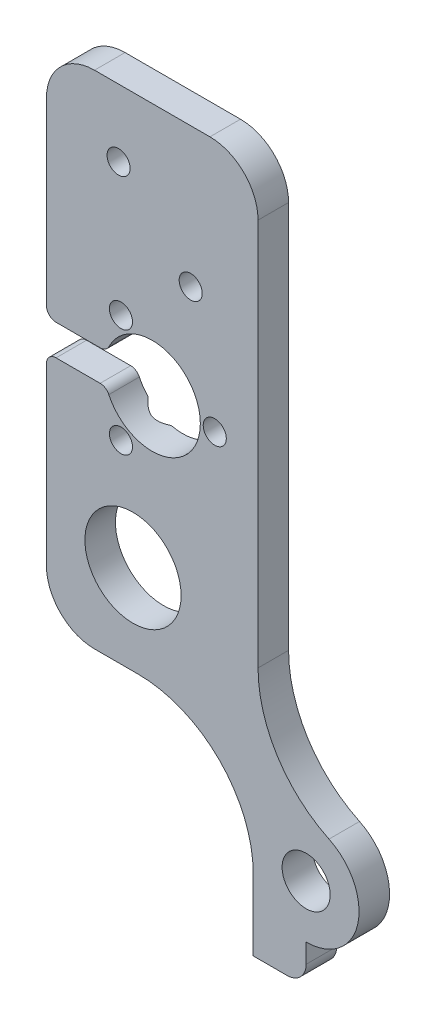
from build123d import *

# Parameters (mm, degrees)
SKETCH1_R                                       = 2.5
SKETCH1_R_2                                     = 5
SKETCH1_R_3                                     = 1
BOSS_EXTRUDE1_DEPTH                             = 3.175
CSK_FOR_M2_FLAT_HEAD_MACHINE_SCREW1_D           = 2.4
CSK_FOR_M2_FLAT_HEAD_MACHINE_SCREW1_CSINK_D     = 4.4
CSK_FOR_M2_FLAT_HEAD_MACHINE_SCREW1_CSINK_ANGLE = 90
SKETCH6_W                                       = 8
SKETCH6_H                                       = 3.2
MOTORSHAFTCUTOUT_DEPTH                          = 68.698453638
F_5MM_FILLET_R                                  = 5
F_1MM_FILLET_R                                  = 1
CUT_EXTRUDE1_DEPTH                              = 68.698453638
FILLET1_R                                       = 5
SKETCH8_W                                       = 5.5
SKETCH8_H                                       = 4
BOSS_EXTRUDE2_DEPTH                             = 3.175
BOSS_EXTRUDE3_DEPTH                             = 3.175
CUT_EXTRUDE3_DEPTH                              = 68.698453638
CUT_EXTRUDE3_DEPTH_BACK                         = 10
FILLET3_R                                       = 12
FILLET4_R                                       = 2
FILLET6_R                                       = 13
CSK_FOR_M2_FLAT_HEAD_MACHINE_SCREW3_D           = 2.4
CSK_FOR_M2_FLAT_HEAD_MACHINE_SCREW3_CSINK_D     = 4.4
CSK_FOR_M2_FLAT_HEAD_MACHINE_SCREW3_CSINK_ANGLE = 90


with BuildPart() as part:
    # Sketch1 → Boss-Extrude1 (new body)
    with BuildSketch(Plane.XY):
        with BuildLine():
            Line((0, -5.5), (-7, -5.5))
            Line((-7, -5.5), (-7, -9))
            Line((-7, -9), (-12, -9))
            Line((-12, -9), (-12, -2.5))
            Line((-12, -2.5), (-27, 4.494614872))
            Line((-27, 4.494614872), (-27, 62))
            Line((-27, 62), (-5, 62))
            Line((-5, 62), (-5, 32.19632141))
            Line((-5, 32.19632141), (-9, 28.19632141))
            Line((-9, 28.19632141), (-9, 10.265347478))
            Line((-9, 10.265347478), (2.32440044, 4.984692829))
            ThreePointArc((2.32440044, 4.984692829), (5.369628039, -1.190417877), (0, -5.5))
        make_face()
        Circle(SKETCH1_R, mode=Mode.SUBTRACT)
        with Locations((-18, 19.2)):
            Circle(SKETCH1_R_2, mode=Mode.SUBTRACT)
        with Locations((-16, 35.679077644)):
            Circle(SKETCH1_R_2, mode=Mode.SUBTRACT)
        with Locations((-9.5, 35.679077644)):
            Circle(SKETCH1_R_3, mode=Mode.SUBTRACT)
        with Locations((-19.25, 30.049912519)):
            Circle(SKETCH1_R_3, mode=Mode.SUBTRACT)
        with Locations((-19.25, 41.308242769)):
            Circle(SKETCH1_R_3, mode=Mode.SUBTRACT)
    extrude(amount=BOSS_EXTRUDE1_DEPTH)

    # CSK for M2 Flat Head Machine Screw1 (through all)
    with Locations(Plane(origin=(0, 0, 0), x_dir=(-1, 0, 0), z_dir=(0, 0, -1))):
        with Locations((19.5, 55), (12, 47.5)):
            CounterSinkHole(CSK_FOR_M2_FLAT_HEAD_MACHINE_SCREW1_D / 2, CSK_FOR_M2_FLAT_HEAD_MACHINE_SCREW1_CSINK_D / 2, counter_sink_angle=CSK_FOR_M2_FLAT_HEAD_MACHINE_SCREW1_CSINK_ANGLE)

    # Sketch6 → MotorShaftCutOut (cut, through all)
    with BuildSketch(Plane(origin=(0, 0, 0), x_dir=(-1, 0, 0), z_dir=(0, 0, -1))):
        with Locations((23, 35.7)):
            Rectangle(SKETCH6_W, SKETCH6_H)
    extrude(amount=-MOTORSHAFTCUTOUT_DEPTH, mode=Mode.SUBTRACT)

    # 5mm_Fillet
    f_5mm_fillet_edges = [part.edges().sort_by_distance(p)[0] for p in [
        (-12, -2.5, 1.5875),
        (-27, 4.494614872, 1.5875),
        (-27, 62, 1.5875),
        (-5, 62, 1.5875),
        (-5, 32.19632141, 1.5875),
        (-9, 28.19632141, 1.5875),
        (-9, 10.265347478, 1.5875),
    ]]
    fillet(f_5mm_fillet_edges, radius=F_5MM_FILLET_R)

    # 1mm_Fillet
    f_1mm_fillet_edges = [part.edges().sort_by_distance(p)[0] for p in [
        (-7, -5.5, 1.5875),
        (-7, -9, 1.5875),
        (-20.744103055, 34.1, 1.5875),
        (-20.72996942, 37.3, 1.5875),
        (-27, 34.1, 1.5875),
        (-27, 37.3, 1.5875),
    ]]
    fillet(f_1mm_fillet_edges, radius=F_1MM_FILLET_R)

    # Sketch7 → Cut-Extrude1 (cut, through all)
    with BuildSketch(Plane(origin=(0, 0, 0), x_dir=(-1, 0, 0), z_dir=(0, 0, -1))):
        with BuildLine():
            Line((12.047193362, -5), (17.277217948, 6.901547918))
            ThreePointArc((17.277217948, 6.901547918), (19.121399551, 9.076749311), (21.854736378, 9.89))
            Line((21.854736378, 9.89), (27, 9.89))
            Line((27, 9.89), (27, -5))
            Line((27, -5), (12.047193362, -5))
        make_face()
    extrude(amount=-CUT_EXTRUDE1_DEPTH, mode=Mode.SUBTRACT)

    # Fillet1
    fillet1_edges = [part.edges().sort_by_distance(p)[0] for p in [
        (-27, 9.89, 1.5875),
    ]]
    fillet(fillet1_edges, radius=FILLET1_R)

    # Sketch8 → Boss-Extrude2 (add)
    with BuildSketch(Plane(origin=(0, 0, 0), x_dir=(-1, 0, 0), z_dir=(0, 0, -1))):
        with Locations((2.75, -7.5)):
            Rectangle(SKETCH8_W, SKETCH8_H)
    extrude(amount=-BOSS_EXTRUDE2_DEPTH)

    # Sketch9 → Boss-Extrude3 (add)
    with BuildSketch(Plane.XY.offset(3.175)):
        with BuildLine():
            Line((-5, 34.267389222), (-5, 8.400116845))
            Line((-5, 8.400116845), (-6.113091309, 8.919159847))
            ThreePointArc((-6.113091309, 8.919159847), (-8.216957229, 10.76420074), (-9, 13.450698782))
            Line((-9, 13.450698782), (-9, 26.125253598))
            ThreePointArc((-9, 26.125253598), (-8.619397663, 28.03867076), (-7.535533906, 29.660787504))
            Line((-7.535533906, 29.660787504), (-6.464466094, 30.731855316))
            ThreePointArc((-6.464466094, 30.731855316), (-5.380602337, 32.35397206), (-5, 34.267389222))
        make_face()
    extrude(amount=-BOSS_EXTRUDE3_DEPTH)

    # Sketch10 → Cut-Extrude3 (cut, two sides: drawn at the far end of the back side and taken through both)
    with BuildSketch(Plane.XY.offset(3.175).offset(-CUT_EXTRUDE3_DEPTH_BACK)):
        with BuildLine():
            Line((-5.5, 9.89), (-21.854736378, 9.89))
            ThreePointArc((-21.854736378, 9.89), (-19.121399551, 9.076749311), (-17.277217948, 6.901547918))
            Line((-17.277217948, 6.901547918), (-13.145595024, -2.500455344))
            ThreePointArc((-13.145595024, -2.500455344), (-12.327289124, -3.906089359), (-12.003436692, -5.5))
            Line((-12.003436692, -5.5), (-6, -5.5))
            Line((-6, -5.5), (-5.5, -5.5))
            Line((-5.5, -5.5), (-5.5, 9.89))
        make_face()
    extrude(amount=CUT_EXTRUDE3_DEPTH + CUT_EXTRUDE3_DEPTH_BACK, mode=Mode.SUBTRACT)


with BuildPart() as body_2:
    # of the pieces the cut leaves, the one that is kept (cut_extrude3_keep)
    add(part.part.solids().sort_by_distance((-22, 9.89, 3.175))[0])

    # Fillet3
    fillet3_edges = [body_2.edges().sort_by_distance(p)[0] for p in [
        (-5.5, 9.89, 1.5875),
    ]]
    fillet(fillet3_edges, radius=FILLET3_R)

    # Fillet4
    fillet4_edges = [body_2.edges().sort_by_distance(p)[0] for p in [
        (0, -9.5, 1.5875),
    ]]
    fillet(fillet4_edges, radius=FILLET4_R)

    # Fillet6
    fillet6_edges = [body_2.edges().sort_by_distance(p)[0] for p in [
        (-5, 8.400116845, 1.5875),
    ]]
    fillet(fillet6_edges, radius=FILLET6_R)

    # CSK for M2 Flat Head Machine Screw3 (through all)
    with Locations(Plane(origin=(0, 0, 0), x_dir=(-1, 0, 0), z_dir=(0, 0, -1))):
        with Locations((19.25, 41.308242769), (9.5, 35.679077644), (19.25, 30.049912519)):
            CounterSinkHole(CSK_FOR_M2_FLAT_HEAD_MACHINE_SCREW3_D / 2, CSK_FOR_M2_FLAT_HEAD_MACHINE_SCREW3_CSINK_D / 2, counter_sink_angle=CSK_FOR_M2_FLAT_HEAD_MACHINE_SCREW3_CSINK_ANGLE)


solid = body_2.part
